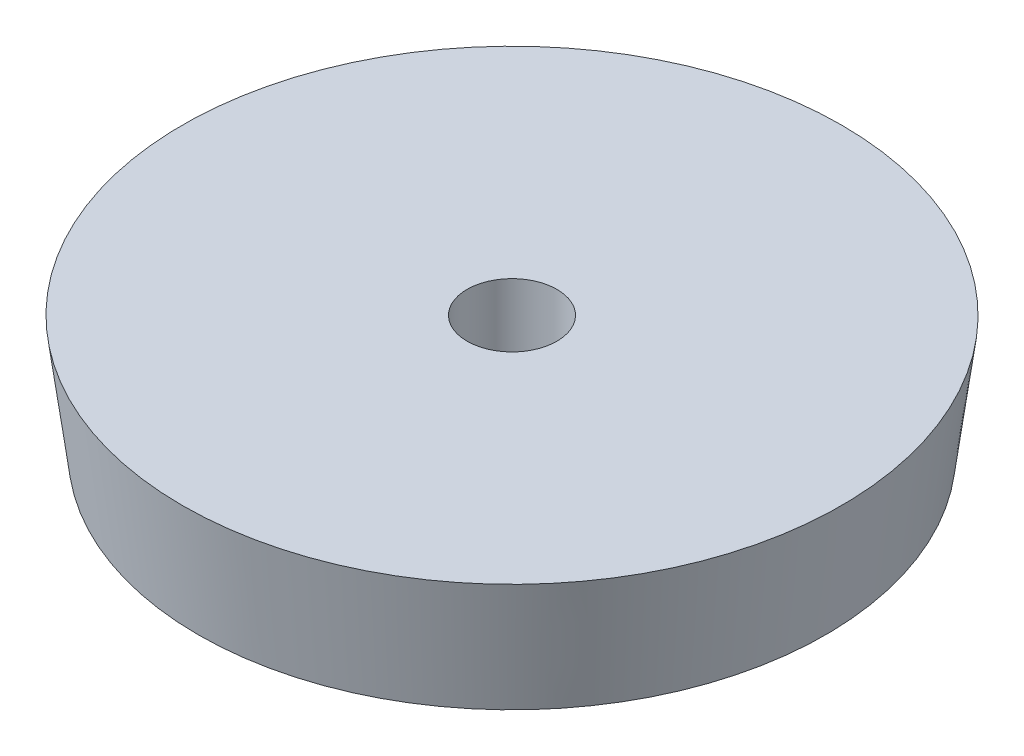
from build123d import *

# Parameters (mm, degrees)
SKETCH1_R           = 104.775
BOSS_EXTRUDE1_DEPTH = 38.1
BOSS_EXTRUDE1_DRAFT = -7.5
SKETCH2_R           = 14.2875
CUT_EXTRUDE1_DEPTH  = 153.9941543


with BuildPart() as part:
    # Sketch1 → Boss-Extrude1 (with draft: the straight prism first)
    with BuildSketch(Plane(origin=(0, 0, 0), x_dir=(1, 0, 0), z_dir=(0, 1, 0))):
        Circle(SKETCH1_R)
    extrude(amount=-BOSS_EXTRUDE1_DEPTH)
    # Boss-Extrude1: the draft: its side faces are tilted about the plane it starts from
    boss_extrude1_sides = [part.faces().sort_by_distance(p)[0] for p in [
        (-104.775, -19.05, 0),
    ]]
    draft(boss_extrude1_sides, Plane(origin=(0, 0, 0), x_dir=(1, 0, 0), z_dir=(0, 1, 0)), BOSS_EXTRUDE1_DRAFT)

    # Sketch2 → Cut-Extrude1 (cut, through all)
    with BuildSketch(Plane(origin=(0, 0, 0), x_dir=(1, 0, 0), z_dir=(0, 1, 0))):
        with Locations(Location((0, 0, 0), (0, 0, 270))):
            Circle(SKETCH2_R)
    extrude(amount=-CUT_EXTRUDE1_DEPTH, mode=Mode.SUBTRACT)


solid = part.part
